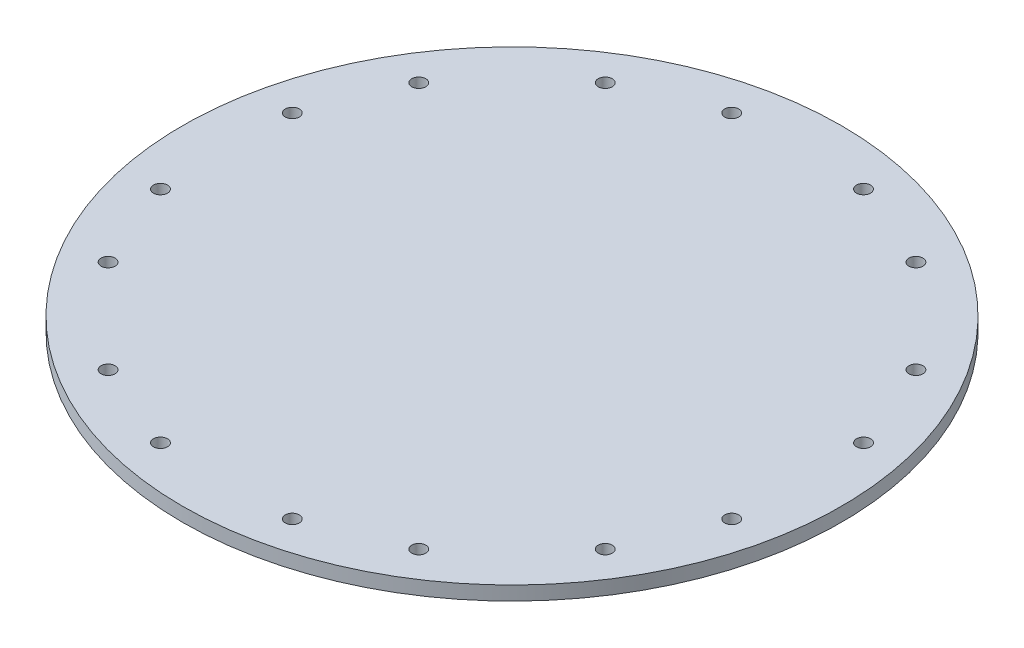
from build123d import *

# Parameters (mm, degrees)
SKETCH1_R            = 150
BOSS_EXTRUDE1_DEPTH  = 6.35
M6_CLEARANCE_HOLE1_D = 6.4
CIRPATTERN1_COUNT    = 8


with BuildPart() as part:
    # Sketch1 → Boss-Extrude1 (new body)
    with BuildSketch(Plane(origin=(0, 0, 0), x_dir=(1, 0, 0), z_dir=(0, 1, 0))):
        with Locations(Location((0, 0, 0), (0, 0, 270))):
            Circle(SKETCH1_R)
    extrude(amount=-BOSS_EXTRUDE1_DEPTH)

    # M6 Clearance Hole1 (through all)
    with Locations(Plane(origin=(-30, 0, -130), x_dir=(0, 0, 1), z_dir=(0, 1, 0))):
        with Locations((0, 0), (0, 60)):
            m6_clearance_hole1 = Hole(M6_CLEARANCE_HOLE1_D / 2)

    # CirPattern1: M6 Clearance Hole1 ×8 about axis
    cirpattern1_axis = Axis((0, 0, 0), (0, 1, 0))
    for i in range(1, CIRPATTERN1_COUNT):
        add(m6_clearance_hole1.rotate(cirpattern1_axis, i * 360 / CIRPATTERN1_COUNT), mode=Mode.SUBTRACT)


solid = part.part
